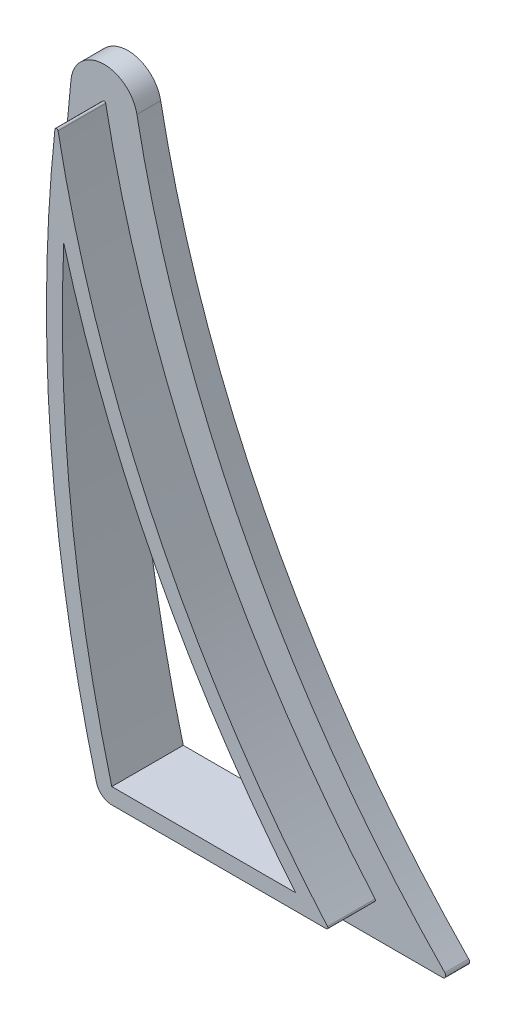
from build123d import *

# Parameters (mm, degrees)
BOSS_EXTRU_1_DEPTH = 3
CONG_1_R           = 0.1
BOSS_EXTRU_2_START = -4.5
BOSS_EXTRU_2_DEPTH = 1.5
CONG_2_R           = 0.2
CONG_3_R           = 0.1


with BuildPart() as part:
    # Esquisse1 → Boss.-Extru.1 (new body)
    with BuildSketch(Plane.XY):
        with BuildLine():
            ThreePointArc((-5.491443118, -17.402412154), (-5.134783325, -17.939342697), (-4.524586287, -18.147093005))
            Line((-4.524586287, -18.147093005), (9.198940383, -18.147093005))
            ThreePointArc((9.198940383, -18.147093005), (-1.821522293, -1.442775514), (-8.03233352, 17.581173717))
            ThreePointArc((-8.03233352, 17.581173717), (-8.390456717, -0.028903657), (-5.491443118, -17.402412154))
        make_face()
        with BuildLine():
            Line((7.041670832, -17.147093005), (-4.524586287, -17.147093005))
            ThreePointArc((-4.524586287, -17.147093005), (-7.101772019, -3.192262147), (-7.54889357, 10.99150579))
            ThreePointArc((-7.54889357, 10.99150579), (-1.736845674, -3.846887542), (7.041670832, -17.147093005))
        make_face(mode=Mode.SUBTRACT)
    extrude(amount=BOSS_EXTRU_1_DEPTH)

    # Congé1
    cong_1_edges = [part.edges().sort_by_distance(p)[0] for p in [
        (-8.03233352, 17.581173717, 1.5),
    ]]
    fillet(cong_1_edges, radius=CONG_1_R)

    # Esquisse2 → Boss.-Extru.2 (add)
    with BuildSketch(Plane.XY.offset(3).offset(BOSS_EXTRU_2_START)):
        with BuildLine():
            ThreePointArc((-7.425156781, -17.913050452), (-6.355177402, -19.523842081), (-4.524586287, -20.147093005))
            Line((-4.524586287, -20.147093005), (13.781531415, -20.147093005))
            ThreePointArc((13.781531415, -20.147093005), (1.144889736, -2.883958877), (-5.944425785, 17.301236646))
            ThreePointArc((-5.944425785, 17.301236646), (-8.095151796, 19.001327524), (-10.094549972, 17.125604115))
            ThreePointArc((-10.094549972, 17.125604115), (-10.359767763, -0.515611426), (-7.425156781, -17.913050452))
        make_face()
        with BuildLine():
            ThreePointArc((-7.54889357, 10.99150579), (-1.736845674, -3.846887542), (7.041670832, -17.147093005))
            Line((7.041670832, -17.147093005), (-4.524586287, -17.147093005))
            ThreePointArc((-4.524586287, -17.147093005), (-7.101772019, -3.192262147), (-7.54889357, 10.99150579))
        make_face(mode=Mode.SUBTRACT)
    extrude(amount=BOSS_EXTRU_2_DEPTH)

    # Congé2
    cong_2_edges = [part.edges().sort_by_distance(p)[0] for p in [
        (13.781531415, -20.147093005, -0.75),
    ]]
    fillet(cong_2_edges, radius=CONG_2_R)

    # Congé3
    cong_3_edges = [part.edges().sort_by_distance(p)[0] for p in [
        (9.198940383, -18.147093005, 1.5),
    ]]
    fillet(cong_3_edges, radius=CONG_3_R)


solid = part.part
